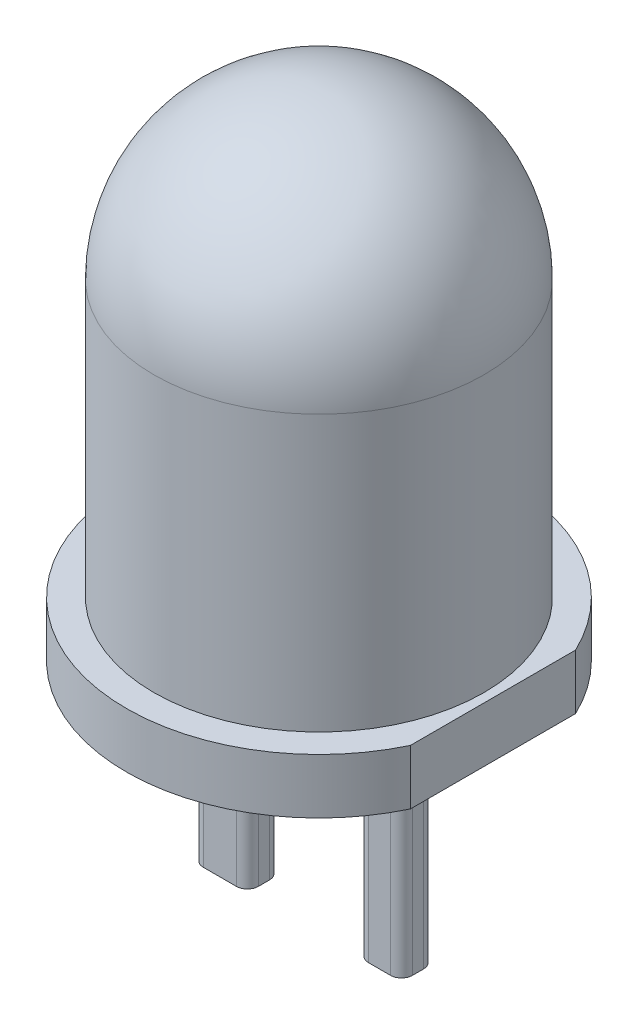
from build123d import *

# Parameters (mm, degrees)
SCHNITT_LINEAR_START            = -1
SCHNITT_LINEAR_AUSTRAGEN1_DEPTH = 1
LINEAR_AUSTRAGEN1_DEPTH         = 2


with BuildPart() as part:
    # Skizze2 → Rotation1 (revolve)
    with BuildSketch(Plane.XY, mode=Mode.PRIVATE) as rotation1_sk:
        with BuildLine():
            Line((0, 0), (-1.75, 0))
            Line((-1.75, 0), (-1.75, 0.5))
            Line((-1.75, 0.5), (-1.5, 0.5))
            Line((-1.5, 0.5), (-1.5, 3))
            ThreePointArc((-1.5, 3), (-1.060660172, 4.060660172), (0, 4.5))
            Line((0, 4.5), (0, 0))
        make_face()
    revolve(rotation1_sk.sketch.rotate(Axis((0, 0, 0), (0, 1, 0)), 270), axis=Axis((0, 0, 0), (0, 1, 0)))

    # Skizze3 → Schnitt-Linear austragen1 (cut)
    with BuildSketch(Plane.XZ.offset(SCHNITT_LINEAR_START)):
        with BuildLine():
            Line((1.58113883, -0.75), (1.58113883, 0.75))
            ThreePointArc((1.58113883, 0.75), (1.75, 0), (1.58113883, -0.75))
        make_face()
    extrude(amount=SCHNITT_LINEAR_AUSTRAGEN1_DEPTH, mode=Mode.SUBTRACT)

    # Skizze4 → Linear austragen1 (add)
    with BuildSketch(Plane.XZ):
        with BuildLine():
            Line((0.6, 0.15), (0.8, 0.15))
            ThreePointArc((0.8, 0.15), (0.870710678, 0.120710678), (0.9, 0.05))
            Line((0.9, 0.05), (0.9, -0.05))
            ThreePointArc((0.9, -0.05), (0.870710678, -0.120710678), (0.8, -0.15))
            Line((0.8, -0.15), (0.6, -0.15))
            ThreePointArc((0.6, -0.15), (0.529289322, -0.120710678), (0.5, -0.05))
            Line((0.5, -0.05), (0.5, 0.05))
            ThreePointArc((0.5, 0.05), (0.529289322, 0.120710678), (0.6, 0.15))
        make_face()
        with BuildLine():
            Line((-0.9, 0.15), (-0.6, 0.15))
            ThreePointArc((-0.6, 0.15), (-0.529289322, 0.120710678), (-0.5, 0.05))
            Line((-0.5, 0.05), (-0.5, -0.05))
            ThreePointArc((-0.5, -0.05), (-0.529289322, -0.120710678), (-0.6, -0.15))
            Line((-0.6, -0.15), (-0.9, -0.15))
            ThreePointArc((-0.9, -0.15), (-0.970710678, -0.120710678), (-1, -0.05))
            Line((-1, -0.05), (-1, 0.05))
            ThreePointArc((-1, 0.05), (-0.970710678, 0.120710678), (-0.9, 0.15))
        make_face()
    extrude(amount=LINEAR_AUSTRAGEN1_DEPTH)


solid = part.part
